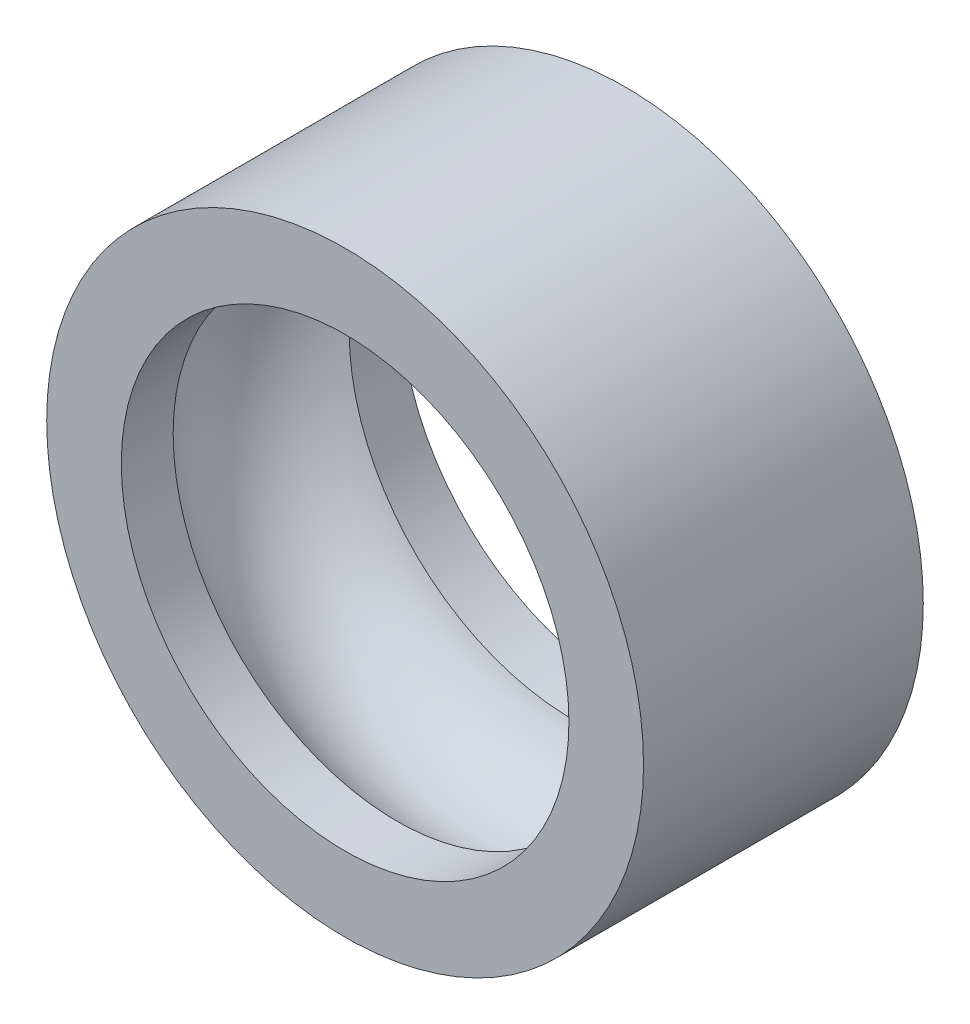
from build123d import *

# Parameters (mm, degrees)
SKETCH2_R           = 3.2
SKETCH2_R_2         = 2.4
BOSS_EXTRUDE1_DEPTH = 3
SKETCH3_R           = 1


with BuildPart() as part:
    # Sketch2 → Boss-Extrude1 (new body)
    with BuildSketch(Plane.XY):
        Circle(SKETCH2_R)
        Circle(SKETCH2_R_2, mode=Mode.SUBTRACT)
    extrude(amount=BOSS_EXTRUDE1_DEPTH)

    # Sketch3 → Cut-Revolve1 (revolve, cut)
    with BuildSketch(Plane(origin=(0, 0, 0), x_dir=(0, 0, -1), z_dir=(1, 0, 0)), mode=Mode.PRIVATE) as cut_revolve1_sk:
        with Locations((-1.5, 2.07)):
            Circle(SKETCH3_R)
    revolve(cut_revolve1_sk.sketch.rotate(Axis((0, 0, 0), (0, 0, 1)), 90), axis=Axis((0, 0, 0), (0, 0, 1)), mode=Mode.SUBTRACT)


solid = part.part
